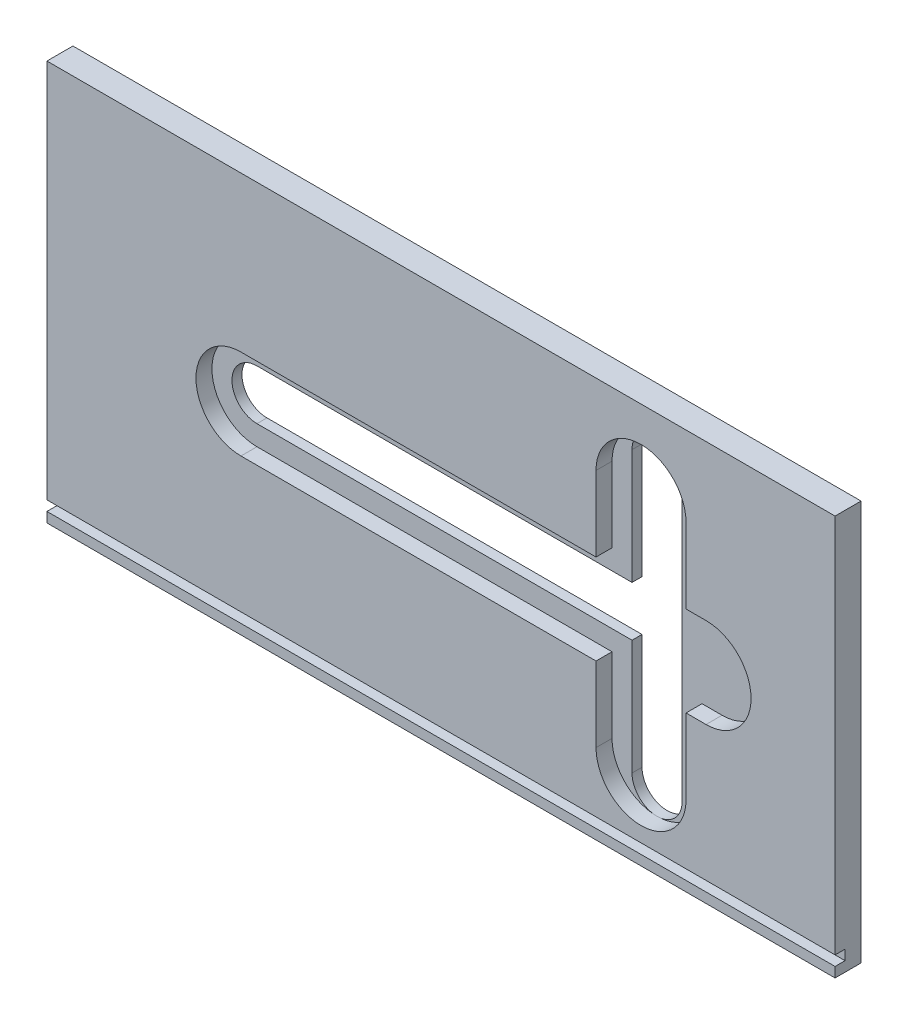
from build123d import *

# Parameters (mm, degrees)
SKETCH_1_W          = 394
SKETCH_1_H          = 200
EXTRUDE_1_DEPTH     = 13
SKETCH_2_W          = 394
SKETCH_2_H          = 5
CUT_EXTRUDE_1_DEPTH = 5
CUT_EXTRUDE_2_DEPTH = 363.900192956
CUT_EXTRUDE_3_DEPTH = 8


with BuildPart() as part:
    # ｽｹｯﾁ1 → ﾎﾞｽ - 押し出し1 (new body)
    with BuildSketch(Plane.XY):
        with Locations((127.719868277, 61.507142857)):
            Rectangle(SKETCH_1_W, SKETCH_1_H)
    extrude(amount=EXTRUDE_1_DEPTH)

    # ｽｹｯﾁ2 → ｶｯﾄ - 押し出し1 (cut)
    with BuildSketch(Plane.XY.offset(13)):
        with Locations((127.719868277, -30.992857143)):
            Rectangle(SKETCH_2_W, SKETCH_2_H)
    extrude(amount=-CUT_EXTRUDE_1_DEPTH, mode=Mode.SUBTRACT)

    # ｽｹｯﾁ3 → ｶｯﾄ - 押し出し2 (cut, through all)
    with BuildSketch(Plane.XY.offset(13)):
        with BuildLine():
            Line((27.719868277, 74.007142857), (215.219868277, 74.007142857))
            Line((215.219868277, 74.007142857), (215.219868277, 131.507142857))
            ThreePointArc((215.219868277, 131.507142857), (227.719868277, 144.007142857), (240.219868277, 131.507142857))
            Line((240.219868277, 131.507142857), (240.219868277, -8.492857143))
            ThreePointArc((240.219868277, -8.492857143), (227.719868277, -20.992857143), (215.219868277, -8.492857143))
            Line((215.219868277, -8.492857143), (215.219868277, 49.007142857))
            Line((215.219868277, 49.007142857), (27.719868277, 49.007142857))
            ThreePointArc((27.719868277, 49.007142857), (15.219868277, 61.507142857), (27.719868277, 74.007142857))
        make_face()
    extrude(amount=-CUT_EXTRUDE_2_DEPTH, mode=Mode.SUBTRACT)

    # ｽｹｯﾁ6 → ｶｯﾄ - 押し出し3 (cut)
    with BuildSketch(Plane.XY.offset(13)):
        with BuildLine():
            Line((27.719868277, 84.007142857), (205.219868277, 84.007142857))
            Line((205.219868277, 84.007142857), (205.219868277, 121.507142857))
            ThreePointArc((205.219868277, 121.507142857), (227.719868277, 144.007142857), (250.219868277, 121.507142857))
            Line((250.219868277, 121.507142857), (250.219868277, 84.007142857))
            Line((250.219868277, 84.007142857), (260.219868277, 84.007142857))
            ThreePointArc((260.219868277, 84.007142857), (282.719868277, 61.507142857), (260.219868277, 39.007142857))
            Line((260.219868277, 39.007142857), (250.219868277, 39.007142857))
            Line((250.219868277, 39.007142857), (250.219868277, 1.507142857))
            ThreePointArc((250.219868277, 1.507142857), (227.719868277, -20.992857143), (205.219868277, 1.507142857))
            Line((205.219868277, 1.507142857), (205.219868277, 39.007142857))
            Line((205.219868277, 39.007142857), (27.719868277, 39.007142857))
            ThreePointArc((27.719868277, 39.007142857), (5.219868277, 61.507142857), (27.719868277, 84.007142857))
        make_face()
    extrude(amount=-CUT_EXTRUDE_3_DEPTH, mode=Mode.SUBTRACT)


solid = part.part
